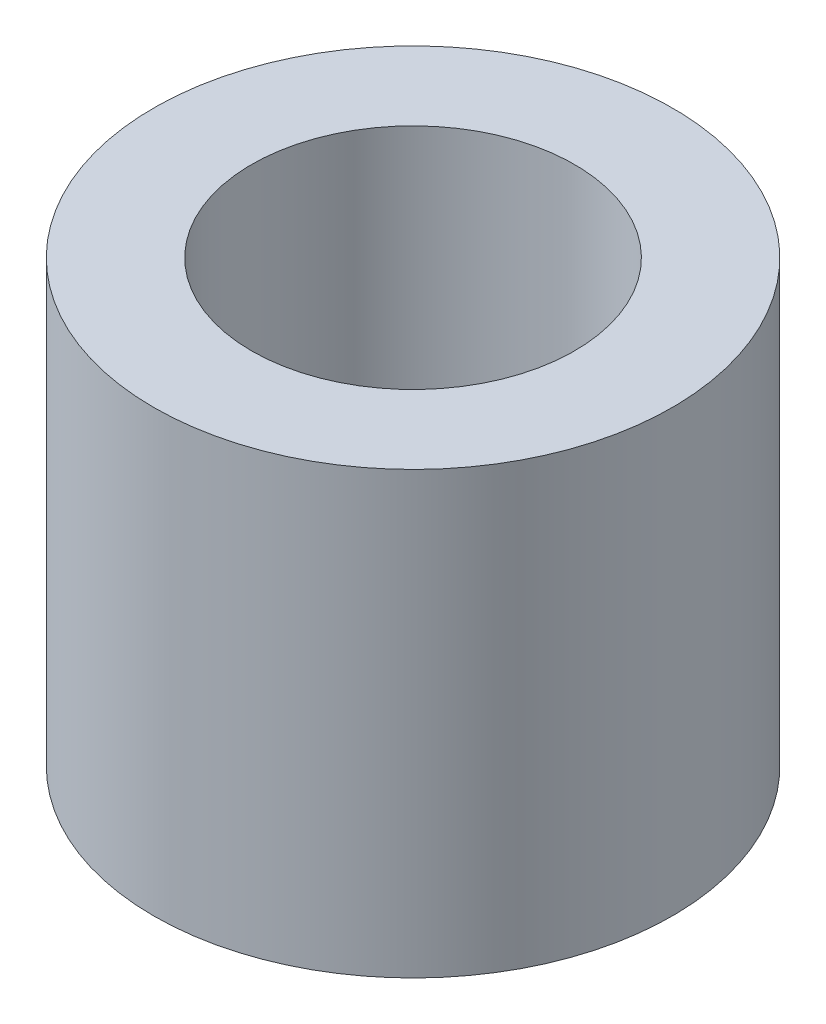
from build123d import *

# Parameters (mm, degrees)
SKETCH1_R           = 2.65
SKETCH1_R_2         = 1.65
BOSS_EXTRUDE1_DEPTH = 4.5


with BuildPart() as part:
    # Sketch1 → Boss-Extrude1 (new body)
    with BuildSketch(Plane(origin=(0, 0, 0), x_dir=(1, 0, 0), z_dir=(0, 1, 0))):
        with Locations(Location((0, 0, 0), (0, 0, 270))):
            Circle(SKETCH1_R)
        with Locations(Location((0, 0, 0), (0, 0, 270))):
            Circle(SKETCH1_R_2, mode=Mode.SUBTRACT)
    extrude(amount=BOSS_EXTRUDE1_DEPTH)


solid = part.part
